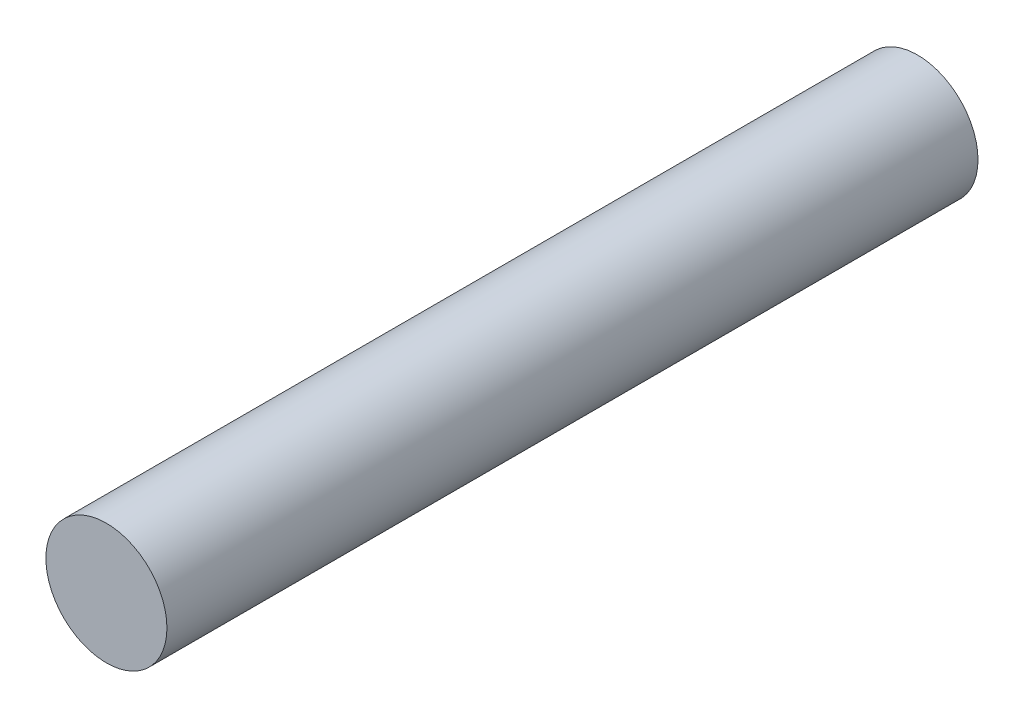
from build123d import *

# Parameters (mm, degrees)
SKETCH1_R           = 5
BOSS_EXTRUDE1_DEPTH = 67


with BuildPart() as part:
    # Sketch1 → Boss-Extrude1 (new body)
    with BuildSketch(Plane.XY):
        Circle(SKETCH1_R)
    extrude(amount=BOSS_EXTRUDE1_DEPTH)


solid = part.part
